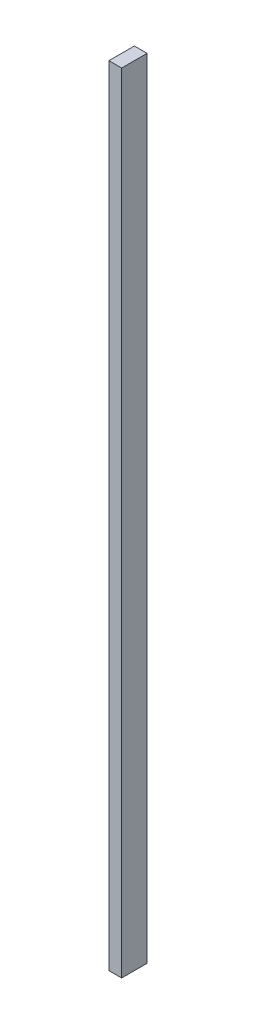
from build123d import *

# Parameters (mm, degrees)
SKETCH_1_W      = 25
SKETCH_1_H      = 50
EXTRUDE_1_DEPTH = 1550


with BuildPart() as part:
    # Эскиз1 → Бобышка-Вытянуть1 (new body)
    with BuildSketch(Plane(origin=(0, 0, 0), x_dir=(1, 0, 0), z_dir=(0, 1, 0))):
        Rectangle(SKETCH_1_W, SKETCH_1_H)
    extrude(amount=EXTRUDE_1_DEPTH)


solid = part.part
